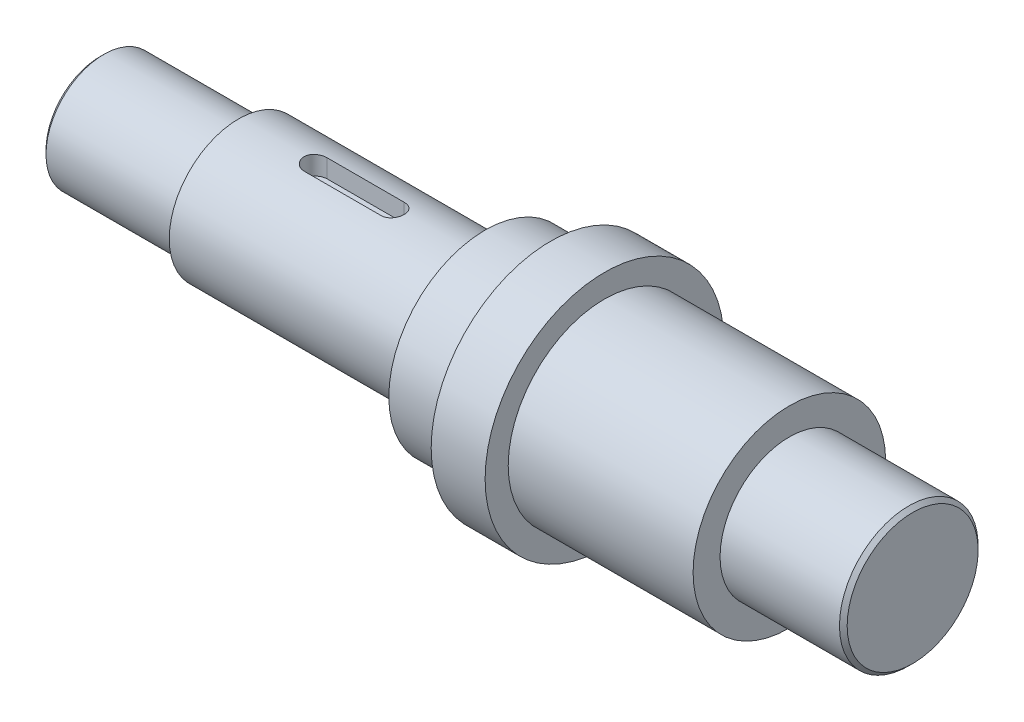
from build123d import *

# Parameters (mm, degrees)
F_02_KEYWAY_DEPTH = 2.5


with BuildPart() as part:
    # 草图1 → 旋转1 (revolve)
    with BuildSketch(Plane.XY, mode=Mode.PRIVATE) as revolve_1_sk:
        Polygon((0, 0), (0, 7), (0.5, 7.5), (18, 7.5), (18, 9), (50, 9), (50, 12.5), (58.5, 12.5), (58.5, 15.5), (65.5, 15.5), (65.5, 12.5), (89.5, 12.5), (89.5, 9), (105, 9), (105.5, 8.5), (105.5, 0), align=None)
    revolve(revolve_1_sk.sketch.rotate(Axis((-5, 0, 0), (1, 0, 0)), 90), axis=Axis((-5, 0, 0), (1, 0, 0)))

    # 草图2 → 02_KEYWAY (cut)
    with BuildSketch(Plane(origin=(0, 9, 0), x_dir=(1, 0, 0), z_dir=(0, 1, 0))):
        with BuildLine():
            Line((28, 1.5), (38, 1.5))
            ThreePointArc((38, 1.5), (39.5, 0), (38, -1.5))
            Line((38, -1.5), (28, -1.5))
            ThreePointArc((28, -1.5), (26.5, 0), (28, 1.5))
        make_face()
    extrude(amount=-F_02_KEYWAY_DEPTH, mode=Mode.SUBTRACT)


solid = part.part
